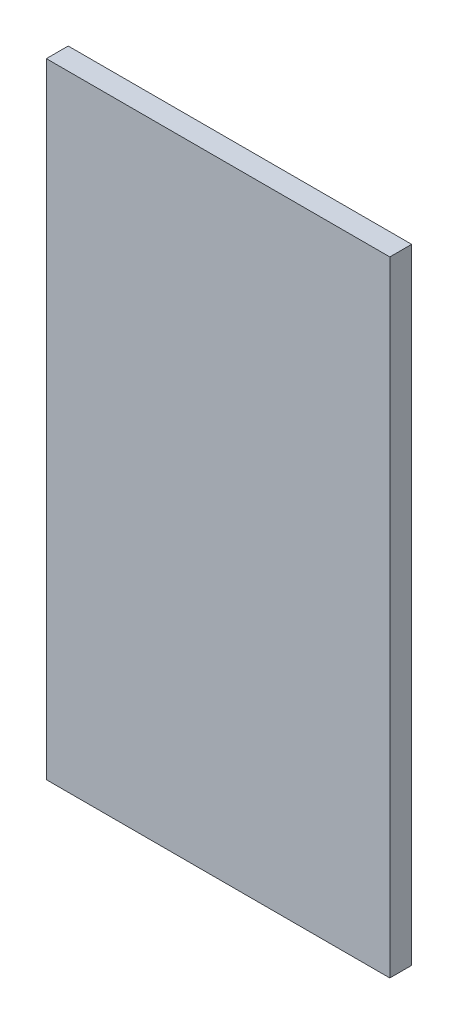
from build123d import *

# Parameters (mm, degrees)
SKETCH_1_W      = 110
SKETCH_1_H      = 200
EXTRUDE_1_DEPTH = 7


with BuildPart() as part:
    # 草图1 → 凸台-拉伸1 (new body)
    with BuildSketch(Plane.XY):
        with Locations((55, 100)):
            Rectangle(SKETCH_1_W, SKETCH_1_H)
    extrude(amount=EXTRUDE_1_DEPTH)


solid = part.part
